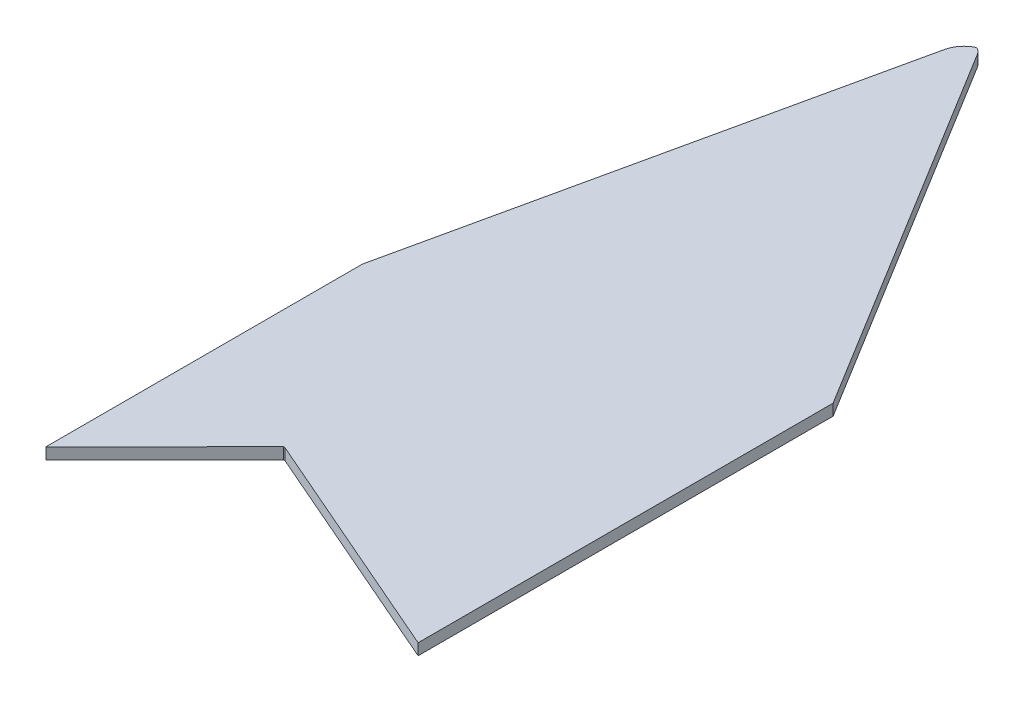
from build123d import *

# Parameters (mm, degrees)
BOSS_EXTRUDE1_DEPTH = 1.27


with BuildPart() as part:
    # Sketch2 → Boss-Extrude1 (new body)
    with BuildSketch(Plane(origin=(0, 0, 0), x_dir=(1, 0, 0), z_dir=(0, 1, 0))):
        with BuildLine():
            Line((-2.543725523, -35.200677289), (-15.887270656, -48.546652053))
            Line((-15.887270656, -48.546652053), (-15.887270656, -12.975156939))
            Line((-15.887270656, -12.975156939), (-4.064387109, 40.624362144))
            ThreePointArc((-4.064387109, 40.624362144), (-3.49318097, 41.819860184), (-2.452860743, 42.640363592))
            ThreePointArc((-2.452860743, 42.640363592), (-2.065756158, 42.410049072), (-1.771451049, 42.069051652))
            Line((-1.771451049, 42.069051652), (24.112729344, -0.05377363))
            Line((24.112729344, -0.05377363), (24.112729344, -46.70931259))
            Line((24.112729344, -46.70931259), (-2.361995962, -35.200677289))
            Line((-2.361995962, -35.200677289), (-2.543725523, -35.200677289))
        make_face()
    extrude(amount=BOSS_EXTRUDE1_DEPTH)


solid = part.part
